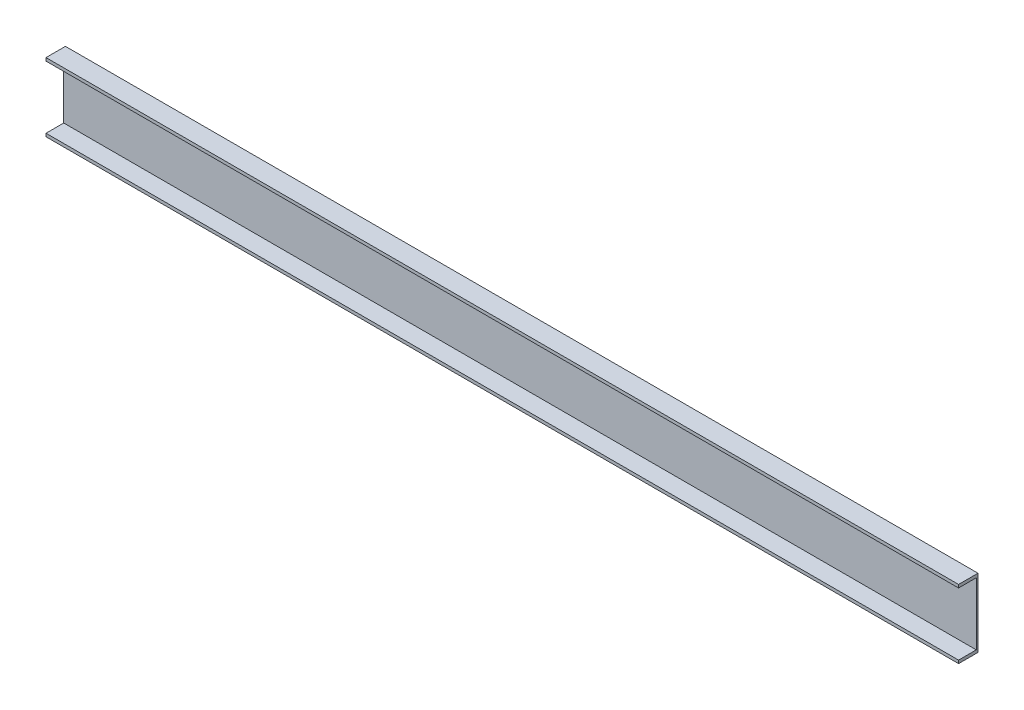
from build123d import *

# Parameters (mm, degrees)
SKETCH_1_W        = 3990
SKETCH_1_H        = 300
EXTRUDE_629_DEPTH = 7.5
SKETCH_2_W        = 3990
SKETCH_2_H        = 13.5
EXTRUDE_1_DEPTH   = 77.5


with BuildPart() as part:
    # 草图1 → Extrude 629 (new body)
    with BuildSketch(Plane.XY):
        Rectangle(SKETCH_1_W, SKETCH_1_H)
    extrude(amount=EXTRUDE_629_DEPTH)

    # 草图2 → 凸台-拉伸1 (add)
    with BuildSketch(Plane.XY.offset(7.5)):
        with Locations((0, 143.25)):
            Rectangle(SKETCH_2_W, SKETCH_2_H)
        with Locations((0, -143.25)):
            Rectangle(SKETCH_2_W, SKETCH_2_H)
    extrude(amount=EXTRUDE_1_DEPTH)


solid = part.part
